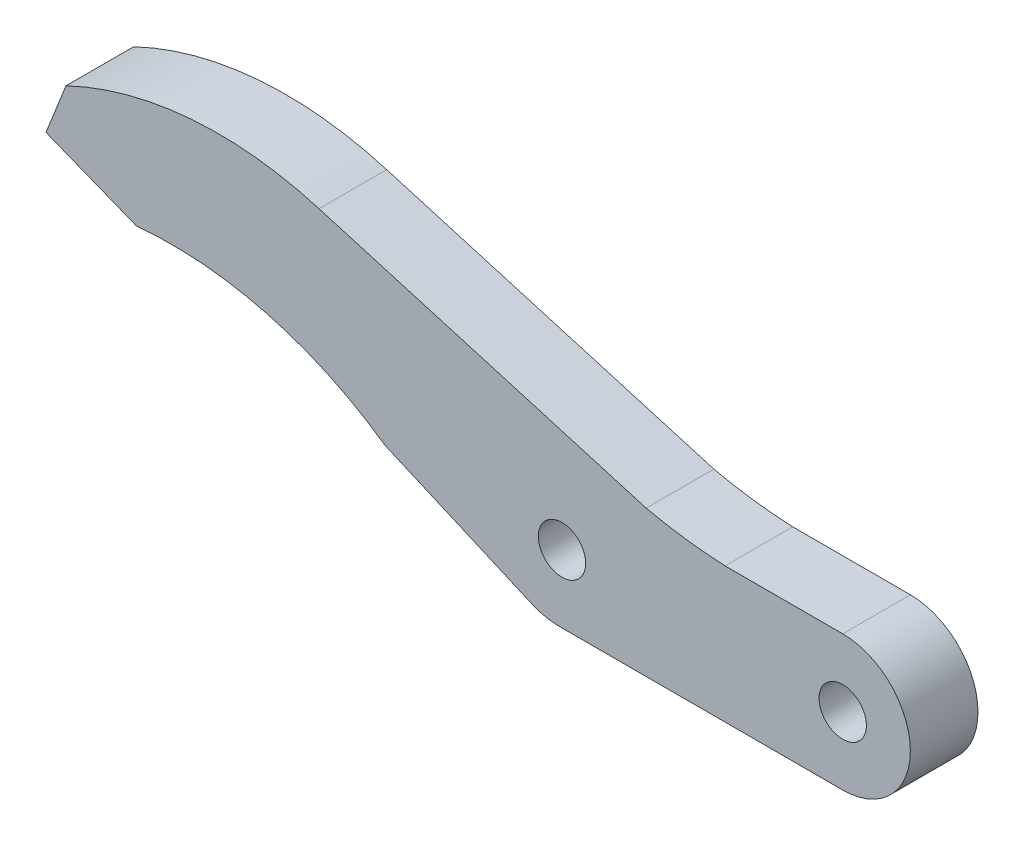
from build123d import *

# Parameters (mm, degrees)
SKETCH2_R           = 1.749985299
SKETCH2_R_2         = 1.75
BOSS_EXTRUDE1_DEPTH = 5
FILLET1_R           = 5


with BuildPart() as part:
    # Sketch2 → Boss-Extrude1 (new body)
    with BuildSketch(Plane.XY):
        with BuildLine():
            Line((-33.828383846, 0.147779708), (-21.999999142, -4.999968857))
            Line((-21.999999142, -4.999968857), (0, -4.999968857))
            ThreePointArc((0, -4.999968857), (4.999968857, 0), (0, 4.999968857))
            Line((0, 4.999968857), (-8.7, 4.999968857))
            ThreePointArc((-8.7, 4.999968857), (-11.628806388, 5.263812443), (-14.523326425, 5.782728669))
            Line((-14.523326425, 5.782728669), (-38.709257265, 12.859504023))
            ThreePointArc((-38.709257265, 12.859504023), (-48.20223144, 13.862553465), (-57.417402301, 11.371912412))
            Line((-57.417402301, 11.371912412), (-58.891567994, 7.653467104))
            Line((-58.891567994, 7.653467104), (-52.198366439, 4.999968857))
            ThreePointArc((-52.198366439, 4.999968857), (-42.578635596, 4.219761872), (-33.828383846, 0.147779708))
        make_face()
        Circle(SKETCH2_R, mode=Mode.SUBTRACT)
        with Locations((-20.75, 0)):
            Circle(SKETCH2_R_2, mode=Mode.SUBTRACT)
    extrude(amount=BOSS_EXTRUDE1_DEPTH)

    # Fillet1
    fillet1_edges = [part.edges().sort_by_distance(p)[0] for p in [
        (-21.999999142, -4.999968857, 2.5),
    ]]
    fillet(fillet1_edges, radius=FILLET1_R)


solid = part.part
